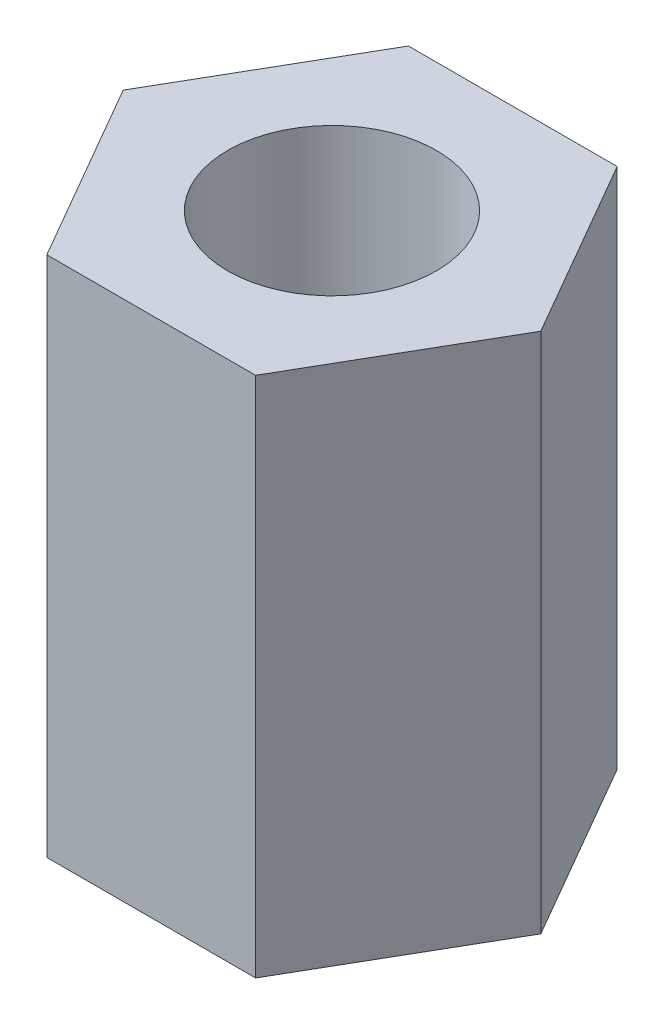
from build123d import *

# Parameters (mm, degrees)
SKETCH_1_R      = 3
EXTRUDE_1_DEPTH = 15


with BuildPart() as part:
    # 草图1 → 凸台-拉伸1 (new body)
    with BuildSketch(Plane(origin=(0, 0, 0), x_dir=(1, 0, 0), z_dir=(0, 1, 0))):
        Polygon((-6, 0), (-3, -5.196152423), (3, -5.196152423), (6, 0), (3, 5.196152423), (-3, 5.196152423), align=None)
        with Locations(Location((0, 0, 0), (0, 0, 270))):
            Circle(SKETCH_1_R, mode=Mode.SUBTRACT)
    extrude(amount=EXTRUDE_1_DEPTH)


solid = part.part
